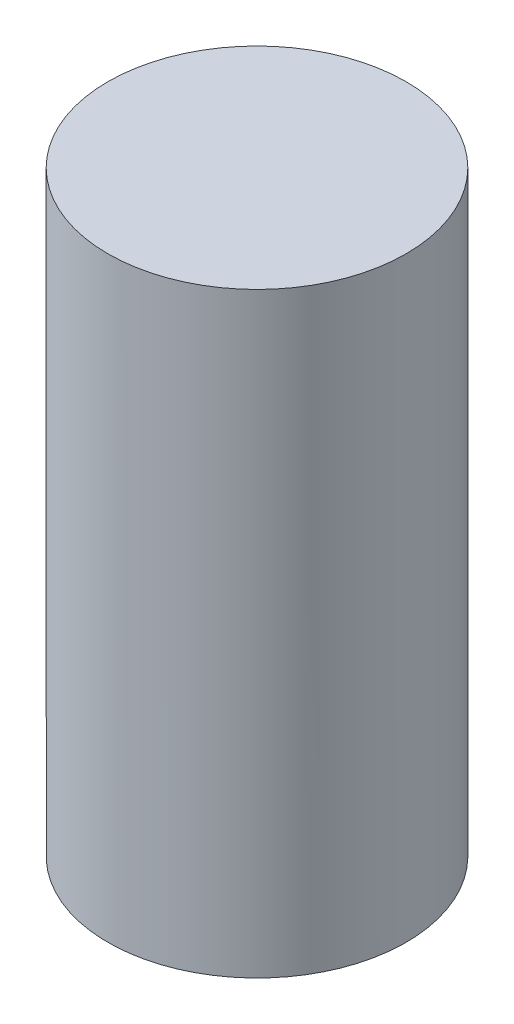
from build123d import *

# Parameters (mm, degrees)
SKETCH2_R           = 5
BOSS_EXTRUDE1_DEPTH = 15
BOSS_EXTRUDE2_START = 2
SKETCH3_R           = 5
SKETCH3_R_2         = 0.75
BOSS_EXTRUDE2_DEPTH = 2
SKETCH4_R           = 5
BOSS_EXTRUDE3_DEPTH = 3


with BuildPart() as part:
    # Sketch2 → Boss-Extrude1 (new body)
    with BuildSketch(Plane(origin=(0, 0, 0), x_dir=(1, 0, 0), z_dir=(0, 1, 0))):
        with Locations(Location((0, 0, 0), (0, 0, 270))):
            Circle(SKETCH2_R)
        with BuildLine():
            Line((1.299038106, 0.75), (3.464101615, -0.5))
            ThreePointArc((3.464101615, -0.5), (3.031088913, 1.75), (1.299038106, 3.25))
            Line((1.299038106, 3.25), (1.299038106, 0.75))
        make_face(mode=Mode.SUBTRACT)
        with BuildLine():
            Line((-1.299038106, 0.75), (-1.299038106, 3.25))
            ThreePointArc((-1.299038106, 3.25), (-3.031088913, 1.75), (-3.464101615, -0.5))
            Line((-3.464101615, -0.5), (-1.299038106, 0.75))
        make_face(mode=Mode.SUBTRACT)
        with BuildLine():
            Line((0, -1.5), (-2.165063509, -2.75))
            ThreePointArc((-2.165063509, -2.75), (0, -3.5), (2.165063509, -2.75))
            Line((2.165063509, -2.75), (0, -1.5))
        make_face(mode=Mode.SUBTRACT)
    extrude(amount=BOSS_EXTRUDE1_DEPTH)

    # Sketch3 → Boss-Extrude2 (add)
    with BuildSketch(Plane.XZ.offset(BOSS_EXTRUDE2_START)):
        with Locations(Location((0, 0, 0), (0, 0, 270))):
            Circle(SKETCH3_R)
        with Locations(Location((0, 2.5, 0), (0, 0, 270))):
            Circle(SKETCH3_R_2, mode=Mode.SUBTRACT)
        with Locations(Location((2.165063509, -1.25, 0), (0, 0, 270))):
            Circle(SKETCH3_R_2, mode=Mode.SUBTRACT)
        with Locations(Location((-2.165063509, -1.25, 0), (0, 0, 270))):
            Circle(SKETCH3_R_2, mode=Mode.SUBTRACT)
    extrude(amount=-BOSS_EXTRUDE2_DEPTH)

    # Sketch4 → Boss-Extrude3 (add)
    with BuildSketch(Plane(origin=(0, 15, 0), x_dir=(1, 0, 0), z_dir=(0, 1, 0))):
        with Locations(Location((0, 0, 0), (0, 0, 90))):
            Circle(SKETCH4_R)
    extrude(amount=BOSS_EXTRUDE3_DEPTH)


solid = part.part
